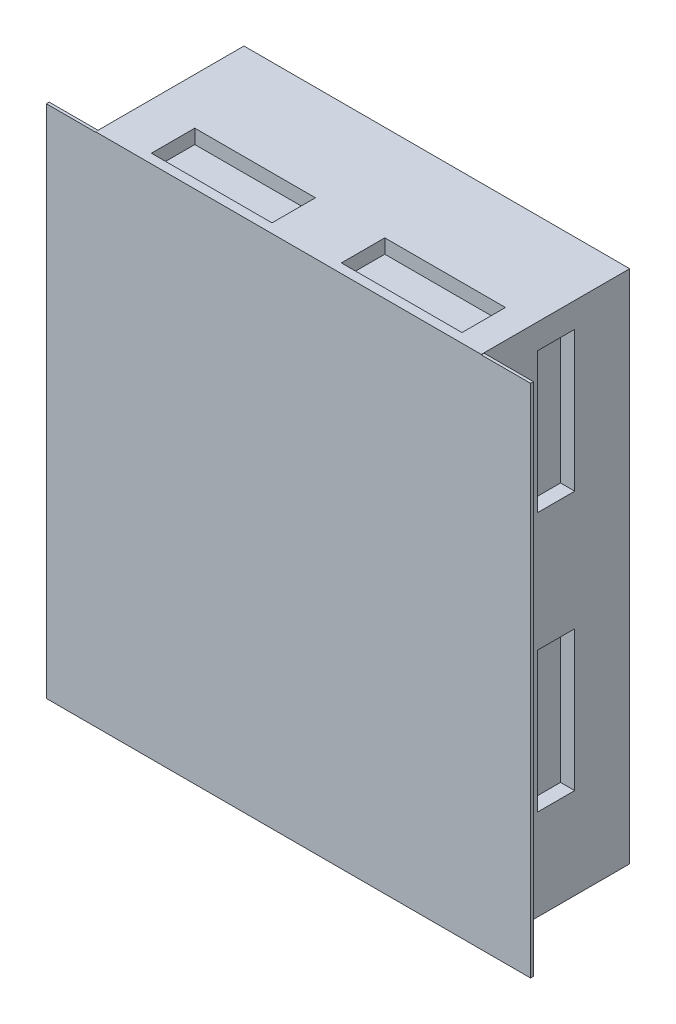
from build123d import *

# Parameters (mm, degrees)
SKETCH1_W           = 135.9
SKETCH1_H           = 52.3
BOSS_EXTRUDE1_DEPTH = 181.6
SKETCH2_W           = 170.6
SKETCH2_H           = 181.46777165
BOSS_EXTRUDE2_DEPTH = 1
BOSS_EXTRUDE3_DEPTH = 6
SKETCH4_W           = 13.2
SKETCH4_H           = 49.4
CUT_EXTRUDE1_DEPTH  = 5
SKETCH5_W           = 42.5
SKETCH5_H           = 15.3
CUT_EXTRUDE2_DEPTH  = 5


with BuildPart() as part:
    # Sketch1 → Boss-Extrude1 (new body)
    with BuildSketch(Plane(origin=(0, 0, 0), x_dir=(1, 0, 0), z_dir=(0, 1, 0))):
        with Locations((0, 1.888738137)):
            Rectangle(SKETCH1_W, SKETCH1_H)
    extrude(amount=BOSS_EXTRUDE1_DEPTH)

    # Sketch2 → Boss-Extrude2 (add)
    with BuildSketch(Plane.XY.offset(24.261261863)):
        with Locations((0, 90.733885825)):
            Rectangle(SKETCH2_W, SKETCH2_H)
    extrude(amount=-BOSS_EXTRUDE2_DEPTH)

    # Sketch3 → Boss-Extrude3 (add)
    # profile 1 of 3: a face of its own
    with BuildSketch(Plane(origin=(0, 0, -28.038738137), x_dir=(-1, 0, 0), z_dir=(0, 0, -1))):
        with BuildLine():
            Line((-12.7, 74.897435897), (-12.7, 77.375360577))
            add(Edge.make_bspline(
                [(-12.7, 77.375360577), (-12.699372317, 77.496660111), (-12.69815571, 77.731768796), (-12.67884905, 78.073624773), (-12.653182672, 78.393931945), (-12.610128703, 78.692124288), (-12.565487417, 78.970142097), (-12.499964695, 79.225162905), (-12.427592462, 79.45932283), (-12.316237959, 79.740500971), (-12.143303013, 80.059536101), (-11.886824054, 80.402439169), (-11.579326494, 80.700511438), (-11.228908769, 80.953961221), (-10.843409562, 81.157360064), (-10.431123013, 81.302648552), (-9.99898535, 81.39598741), (-9.702715027, 81.405466055), (-9.552984776, 81.41025641)],
                knots=[0, 0, 0, 0, 1.00128172, 1.940733171, 2.826250472, 3.653024905, 4.427672124, 5.149348099, 5.824709082, 6.450061444, 7.643590664, 8.808605388, 9.972104426, 11.165284501, 12.367876273, 13.557044126, 14.765369432, 16, 16, 16, 16], degree=3))
            add(Edge.make_bspline(
                [(-9.552984776, 81.41025641), (-9.412737383, 81.406266394), (-9.137138031, 81.398425636), (-8.734737295, 81.324362973), (-8.352077719, 81.20681494), (-7.989486801, 81.044358817), (-7.653714203, 80.835043193), (-7.345800058, 80.584253653), (-7.077381826, 80.282932025), (-6.927377362, 80.057060317), (-6.851181891, 79.942327724)],
                knots=[0, 0, 0, 0, 1.044641374, 2.052818814, 3.038628718, 4.023282556, 5.005660861, 5.98021751, 6.974042014, 8, 8, 8, 8], degree=3))
            add(Edge.make_bspline(
                [(-6.851181891, 79.942327724), (-6.795773816, 80.086587345), (-6.689764444, 80.362591734), (-6.502634166, 80.742633146), (-6.298363579, 81.068868884), (-6.078736215, 81.347671798), (-5.838509805, 81.584860909), (-5.575732619, 81.790280394), (-5.290619783, 81.967869542), (-4.984219176, 82.118996678), (-4.659128296, 82.237708928), (-4.319317807, 82.324960787), (-3.966090372, 82.376572158), (-3.726383162, 82.383612741), (-3.604947917, 82.387179487)],
                knots=[0, 0, 0, 0, 1.272586185, 2.434772614, 3.483318042, 4.437947805, 5.351807173, 6.25737843, 7.180033415, 8.1141739, 9.066731021, 10.025721652, 10.999834114, 12, 12, 12, 12], degree=3))
            add(Edge.make_bspline(
                [(-3.604947917, 82.387179487), (-3.480970476, 82.383635706), (-3.237041389, 82.376663218), (-2.878708535, 82.325199112), (-2.536235817, 82.238121022), (-2.207565879, 82.117970372), (-1.893387826, 81.96223513), (-1.594839821, 81.769971256), (-1.311300739, 81.543877749), (-1.042270168, 81.288355541), (-0.796098738, 81.00359603), (-0.584474326, 80.689772721), (-0.402507492, 80.355482844), (-0.254356585, 79.996452821), (-0.140058258, 79.613599181), (-0.060423762, 79.207134965), (-0.006676125, 78.77772956), (-0.002263135, 78.48305202), (0, 78.33193109)],
                knots=[0, 0, 0, 0, 0.978680899, 1.925582087, 2.851223405, 3.764209995, 4.683484765, 5.614004905, 6.562443559, 7.542772147, 8.539900013, 9.527881485, 10.525548727, 11.540192123, 12.58875426, 13.674701727, 14.807505862, 16, 16, 16, 16], degree=3))
            Line((0, 78.33193109), (0, 74.897435897))
            Line((0, 74.897435897), (-12.7, 74.897435897))
        make_face()
        with BuildLine():
            Line((-11.397435897, 76.037179487), (-7.326923077, 76.037179487))
            Line((-7.326923077, 76.037179487), (-7.326923077, 76.802944712))
            add(Edge.make_bspline(
                [(-7.326923077, 76.802944712), (-7.328374226, 76.914881769), (-7.331178141, 77.131166976), (-7.339210049, 77.444384883), (-7.361700083, 77.735124246), (-7.384183694, 78.002883146), (-7.420739951, 78.247240135), (-7.464254566, 78.46765318), (-7.510274294, 78.667583653), (-7.588545357, 78.898136035), (-7.704184303, 79.159694499), (-7.883820739, 79.438344227), (-8.097610778, 79.685137216), (-8.346602328, 79.891040873), (-8.617797908, 80.061045084), (-8.908816675, 80.18013838), (-9.213802254, 80.259534335), (-9.423579537, 80.266815839), (-9.530088141, 80.270512821)],
                knots=[0, 0, 0, 0, 1.156917035, 2.235399477, 3.236897345, 4.169954739, 5.01148057, 5.788325709, 6.491867502, 7.129259015, 8.302032419, 9.437271567, 10.542795419, 11.662606952, 12.764338259, 13.836858145, 14.901724648, 16, 16, 16, 16], degree=3))
            add(Edge.make_bspline(
                [(-9.530088141, 80.270512821), (-9.600585181, 80.26863572), (-9.738872822, 80.264953584), (-9.941119209, 80.233701339), (-10.131156629, 80.183064407), (-10.310808966, 80.11448835), (-10.475611427, 80.020803281), (-10.633438701, 79.912209977), (-10.774837705, 79.778136125), (-10.906615938, 79.626620769), (-11.024557016, 79.453260178), (-11.12225292, 79.254319294), (-11.210797869, 79.034941042), (-11.276345062, 78.789173572), (-11.333983541, 78.522109268), (-11.370198184, 78.230131982), (-11.393502651, 77.915091911), (-11.396095572, 77.69680871), (-11.397435897, 77.583974359)],
                knots=[0, 0, 0, 0, 0.911708768, 1.788416306, 2.640049961, 3.452993646, 4.268229297, 5.087074648, 5.92553149, 6.781184137, 7.681934069, 8.628939405, 9.643570426, 10.73771997, 11.914765019, 13.176320755, 14.540391495, 16, 16, 16, 16], degree=3))
            Line((-11.397435897, 77.583974359), (-11.397435897, 76.037179487))
        make_face(mode=Mode.SUBTRACT)
        with BuildLine():
            Line((-6.024358974, 76.037179487), (-1.302564103, 76.037179487))
            Line((-1.302564103, 76.037179487), (-1.302564103, 77.660296474))
            add(Edge.make_bspline(
                [(-1.302564103, 77.660296474), (-1.304095014, 77.776467283), (-1.307045645, 78.000371201), (-1.313965487, 78.323904573), (-1.340142198, 78.622987489), (-1.364290096, 78.898563446), (-1.405581964, 79.149901065), (-1.444550751, 79.378933649), (-1.502397133, 79.58190147), (-1.581900179, 79.819420779), (-1.709174685, 80.084912467), (-1.895121537, 80.375047094), (-2.124608659, 80.628039992), (-2.385606798, 80.845210778), (-2.668608428, 81.024429542), (-2.969913842, 81.153035957), (-3.283663222, 81.23295657), (-3.497637425, 81.242599739), (-3.604947917, 81.247435897)],
                knots=[0, 0, 0, 0, 1.160376723, 2.23647316, 3.230273494, 4.158083346, 4.997711197, 5.773399541, 6.476071462, 7.102777513, 8.27340052, 9.405620712, 10.53304798, 11.669441455, 12.787990954, 13.865552736, 14.929550474, 16, 16, 16, 16], degree=3))
            add(Edge.make_bspline(
                [(-3.604947917, 81.247435897), (-3.672053769, 81.246437101), (-3.80518305, 81.24445562), (-4.00079938, 81.214436658), (-4.190382539, 81.171008733), (-4.374722549, 81.113812907), (-4.550719976, 81.033856226), (-4.719049771, 80.935836036), (-4.883102884, 80.823634513), (-5.093187107, 80.650528786), (-5.33223381, 80.395068893), (-5.563384345, 80.032031878), (-5.752809969, 79.621525095), (-5.832891015, 79.323092734), (-5.874258814, 79.168930288)],
                knots=[0, 0, 0, 0, 0.723302347, 1.434937762, 2.129609326, 2.821140842, 3.513216847, 4.209993937, 4.920569932, 5.655069131, 7.14393391, 8.6716197, 10.280644748, 12, 12, 12, 12], degree=3))
            add(Edge.make_bspline(
                [(-5.874258814, 79.168930288), (-5.886795833, 79.107138998), (-5.913978676, 78.973162734), (-5.942672343, 78.754695228), (-5.968235846, 78.505282218), (-5.987144903, 78.224347778), (-6.006690361, 77.911536469), (-6.01429157, 77.566180221), (-6.023360313, 77.189689393), (-6.024017572, 76.928459928), (-6.024358974, 76.792768429)],
                knots=[0, 0, 0, 0, 0.634451884, 1.375622551, 2.216452059, 3.157844607, 4.20941857, 5.370758133, 6.634282058, 8, 8, 8, 8], degree=3))
            Line((-6.024358974, 76.792768429), (-6.024358974, 76.037179487))
        make_face(mode=Mode.SUBTRACT)
    # profile 2 of 3: a face of its own
    with BuildSketch(Plane(origin=(0, 0, -28.038738137), x_dir=(-1, 0, 0), z_dir=(0, 0, -1))):
        Polygon((0, 84.341025641), (-12.7, 86.017568109), (-12.7, 86.180388622), (-2.279487179, 91.423717949), (-12.7, 96.654326923), (-12.7, 96.819691506), (0, 98.506410256), (0, 97.361578526), (-9.138301282, 96.145512821), (0, 91.561097756), (0, 91.304146635), (-9.158653846, 86.701923077), (0, 85.488401442), align=None)
    # profile 3 of 3: a face of its own
    with BuildSketch(Plane(origin=(0, 0, -28.038738137), x_dir=(-1, 0, 0), z_dir=(0, 0, -1))):
        with BuildLine():
            Line((-2.449939904, 99.808974359), (-3.093589744, 100.882572115))
            add(Edge.make_bspline(
                [(-3.093589744, 100.882572115), (-2.926441832, 100.982424005), (-2.606192885, 101.173736372), (-2.173456567, 101.492874161), (-1.805656741, 101.823556438), (-1.504933051, 102.16823202), (-1.268172805, 102.524797032), (-1.100524707, 102.89557917), (-0.995963882, 103.27932894), (-0.983263568, 103.540491092), (-0.976923077, 103.670873397)],
                knots=[0, 0, 0, 0, 1.272034388, 2.437168799, 3.508375237, 4.49857839, 5.41946034, 6.295179144, 7.148887113, 8, 8, 8, 8], degree=3))
            add(Edge.make_bspline(
                [(-0.976923077, 103.670873397), (-0.980098097, 103.78220032), (-0.986392582, 104.002906206), (-1.044430861, 104.32845764), (-1.139381365, 104.643051192), (-1.268097053, 104.943559604), (-1.426316618, 105.222021371), (-1.612887178, 105.470120965), (-1.828462782, 105.679614769), (-2.065057372, 105.853287666), (-2.318766121, 105.987674491), (-2.580176948, 106.08924536), (-2.852876607, 106.146130517), (-3.036527641, 106.154666629), (-3.129206731, 106.158974359)],
                knots=[0, 0, 0, 0, 1.09553864, 2.171907928, 3.244545276, 4.325730702, 5.384330216, 6.391480148, 7.371786628, 8.333890167, 9.27165687, 10.191402356, 11.087295184, 12, 12, 12, 12], degree=3))
            add(Edge.make_bspline(
                [(-3.129206731, 106.158974359), (-3.234981678, 106.153739616), (-3.449187481, 106.143138691), (-3.765763708, 106.049712033), (-4.080405344, 105.907053436), (-4.275068124, 105.772970388), (-4.375801282, 105.703585737)],
                knots=[0, 0, 0, 0, 0.938992559, 1.901562324, 2.914110574, 4, 4, 4, 4], degree=3))
            add(Edge.make_bspline(
                [(-4.375801282, 105.703585737), (-4.44855181, 105.64673213), (-4.601282444, 105.527375094), (-4.828433672, 105.322005753), (-5.063214745, 105.082245695), (-5.31077993, 104.811376418), (-5.569072987, 104.508943559), (-5.8401095, 104.174830107), (-6.118350813, 103.806184594), (-6.304718666, 103.547433553), (-6.40088141, 103.413922276)],
                knots=[0, 0, 0, 0, 0.72225051, 1.516274602, 2.393638633, 3.3469932, 4.386926276, 5.505032946, 6.712638081, 8, 8, 8, 8], degree=3))
            add(Edge.make_bspline(
                [(-6.40088141, 103.413922276), (-6.496053714, 103.280303775), (-6.678015911, 103.024835377), (-6.948069742, 102.667571379), (-7.194971783, 102.348095756), (-7.421046341, 102.067828467), (-7.626324078, 101.826892787), (-7.808833743, 101.623390124), (-7.973511235, 101.462504503), (-8.080341247, 101.373039967), (-8.128305288, 101.332872596)],
                knots=[0, 0, 0, 0, 1.452282411, 2.77665338, 3.964542531, 5.026858415, 5.96415736, 6.766646006, 7.446254459, 8, 8, 8, 8], degree=3))
            add(Edge.make_bspline(
                [(-8.128305288, 101.332872596), (-8.203061333, 101.276738771), (-8.350079127, 101.16634407), (-8.579805018, 101.020464755), (-8.814519473, 100.897444333), (-9.055073148, 100.798435892), (-9.299658139, 100.718371518), (-9.550110695, 100.662706238), (-9.804730594, 100.628395336), (-9.976042223, 100.624851118), (-10.061798878, 100.623076923)],
                knots=[0, 0, 0, 0, 1.068019517, 2.100403715, 3.106014851, 4.09224787, 5.069873182, 6.043214339, 7.020455327, 8, 8, 8, 8], degree=3))
            add(Edge.make_bspline(
                [(-10.061798878, 100.623076923), (-10.196164323, 100.627812756), (-10.462023245, 100.637183198), (-10.850388447, 100.716436134), (-11.221193366, 100.841512091), (-11.570681509, 101.01679636), (-11.890071901, 101.242541465), (-12.182239357, 101.504920656), (-12.431208535, 101.814535247), (-12.645348186, 102.157301617), (-12.814690808, 102.530515062), (-12.937413997, 102.923427663), (-13.010310029, 103.333215039), (-13.020480481, 103.611221575), (-13.025641026, 103.752283654)],
                knots=[0, 0, 0, 0, 1.005248779, 1.989011071, 2.95484373, 3.928844559, 4.904706341, 5.875556129, 6.859318422, 7.868909462, 8.894684146, 9.918924798, 10.944050749, 12, 12, 12, 12], degree=3))
            add(Edge.make_bspline(
                [(-13.025641026, 103.752283654), (-13.020549285, 103.90196505), (-13.010423439, 104.199633574), (-12.920190732, 104.636788328), (-12.776581296, 105.05939938), (-12.608089803, 105.397855253), (-12.440878214, 105.663308477), (-12.288243775, 105.865547256), (-12.112888377, 106.071599983), (-11.911115259, 106.279252208), (-11.686960086, 106.490553889), (-11.438525366, 106.704531722), (-11.168049902, 106.923188172), (-10.974912741, 107.063808675), (-10.875901442, 107.135897436)],
                knots=[0, 0, 0, 0, 1.286507425, 2.558452658, 3.822738219, 5.118007103, 5.800084425, 6.519418873, 7.295692132, 8.12638276, 9.008892966, 9.945018126, 10.946518512, 12, 12, 12, 12], degree=3))
            Line((-10.875901442, 107.135897436), (-10.094871795, 106.105548878))
            add(Edge.make_bspline(
                [(-10.094871795, 106.105548878), (-10.175026824, 106.043338173), (-10.32938667, 105.923534901), (-10.545483741, 105.741576141), (-10.743146913, 105.570335507), (-10.914381231, 105.400331009), (-11.072009393, 105.244666548), (-11.204569572, 105.090901567), (-11.316250039, 104.944969876), (-11.435651319, 104.761464808), (-11.550429634, 104.529005922), (-11.651248892, 104.239632019), (-11.711060256, 103.936202431), (-11.719038173, 103.729647009), (-11.723076923, 103.625080128)],
                knots=[0, 0, 0, 0, 1.181392137, 2.275085037, 3.289537922, 4.225335853, 5.084247276, 5.86831218, 6.587234301, 7.222706459, 8.415108401, 9.595592188, 10.782789524, 12, 12, 12, 12], degree=3))
            add(Edge.make_bspline(
                [(-11.723076923, 103.625080128), (-11.718752177, 103.493852643), (-11.710412313, 103.240792801), (-11.6169317, 102.882358919), (-11.474800726, 102.55788681), (-11.269849343, 102.279763141), (-11.025507819, 102.050120741), (-10.746853518, 101.881944814), (-10.439090687, 101.781395384), (-10.224507915, 101.769088308), (-10.115224359, 101.762820513)],
                knots=[0, 0, 0, 0, 1.144248881, 2.206576175, 3.214949548, 4.222996039, 5.203671638, 6.127710127, 7.046472867, 8, 8, 8, 8], degree=3))
            add(Edge.make_bspline(
                [(-10.115224359, 101.762820513), (-10.047198882, 101.764328492), (-9.910200307, 101.767365458), (-9.708759769, 101.806172964), (-9.508381362, 101.858643902), (-9.309770314, 101.939084365), (-9.10842921, 102.051104372), (-8.901514272, 102.198050628), (-8.687243251, 102.383165272), (-8.547879003, 102.524957622), (-8.474298878, 102.599819712)],
                knots=[0, 0, 0, 0, 0.858259122, 1.72847414, 2.583651051, 3.473048463, 4.427392529, 5.488649985, 6.674082839, 8, 8, 8, 8], degree=3))
            add(Edge.make_bspline(
                [(-8.474298878, 102.599819712), (-8.449490242, 102.627619549), (-8.3905506, 102.693665598), (-8.29405861, 102.814409671), (-8.175031408, 102.973859253), (-8.027757431, 103.167850669), (-7.856918983, 103.39996081), (-7.664700447, 103.6702152), (-7.444861782, 103.975601333), (-7.29116442, 104.192306571), (-7.209895833, 104.306891026)],
                knots=[0, 0, 0, 0, 0.420754252, 0.999615792, 1.744751191, 2.668019286, 3.750313428, 4.999500688, 6.413464383, 8, 8, 8, 8], degree=3))
            add(Edge.make_bspline(
                [(-7.209895833, 104.306891026), (-7.109597115, 104.444725528), (-6.915382548, 104.711622938), (-6.623589467, 105.091381758), (-6.338207139, 105.435706214), (-6.06107656, 105.745830683), (-5.794237908, 106.024733648), (-5.53468775, 106.269603606), (-5.28412818, 106.48155159), (-4.965079672, 106.712844905), (-4.569607367, 106.946382589), (-4.084860795, 107.146621958), (-3.598723152, 107.274010817), (-3.272402448, 107.290555115), (-3.111398237, 107.298717949)],
                knots=[0, 0, 0, 0, 1.163604038, 2.253157948, 3.268574773, 4.215621239, 5.091738613, 5.902582348, 6.650434646, 7.330118262, 8.591011492, 9.77460283, 10.902005569, 12, 12, 12, 12], degree=3))
            add(Edge.make_bspline(
                [(-3.111398237, 107.298717949), (-2.997540804, 107.296331046), (-2.772036973, 107.291603592), (-2.440893869, 107.237352188), (-2.119355657, 107.157683682), (-1.811714808, 107.038572643), (-1.513035142, 106.89082255), (-1.228943203, 106.706029727), (-0.953919697, 106.49071111), (-0.695674961, 106.243841715), (-0.458314775, 105.973848166), (-0.24804448, 105.687456451), (-0.068682233, 105.38765624), (0.074162208, 105.0712009), (0.186635166, 104.741489999), (0.267899266, 104.397436274), (0.317829828, 104.038691204), (0.323008226, 103.794848079), (0.325641026, 103.670873397)],
                knots=[0, 0, 0, 0, 0.983922938, 1.948738757, 2.895227473, 3.844781104, 4.796118043, 5.772795661, 6.770647148, 7.813532943, 8.8582745, 9.876489951, 10.882905461, 11.874265028, 12.874055871, 13.891769171, 14.928133632, 16, 16, 16, 16], degree=3))
            add(Edge.make_bspline(
                [(0.325641026, 103.670873397), (0.323786166, 103.574950867), (0.320099808, 103.384313853), (0.287510594, 103.102339443), (0.241401949, 102.82606152), (0.168198939, 102.558946787), (0.079382315, 102.297554086), (-0.029976158, 102.043019109), (-0.161032351, 101.795222894), (-0.310865281, 101.552759953), (-0.485281322, 101.31631193), (-0.688245291, 101.087840197), (-0.914581665, 100.8613343), (-1.167786954, 100.638400996), (-1.450645541, 100.423903986), (-1.758944131, 100.212693885), (-2.093599536, 100.005800015), (-2.328941218, 99.875808341), (-2.449939904, 99.808974359)],
                knots=[0, 0, 0, 0, 0.915313873, 1.819100311, 2.706792138, 3.586475221, 4.459428225, 5.3405999, 6.2277379, 7.133009489, 8.059106158, 9.028520402, 10.047404263, 11.114294124, 12.246039232, 13.433834781, 14.680630578, 16, 16, 16, 16], degree=3))
        make_face()
    extrude(amount=BOSS_EXTRUDE3_DEPTH)

    # Sketch4 → Cut-Extrude1 (cut)
    with BuildSketch(Plane(origin=(67.95, 0, 0), x_dir=(0, 0, -1), z_dir=(1, 0, 0))):
        with Locations((2.066635523, 56.7445243)):
            Rectangle(SKETCH4_W, SKETCH4_H)
        with Locations((2.066635523, 148.09795399)):
            Rectangle(SKETCH4_W, SKETCH4_H)
    extrude(amount=-CUT_EXTRUDE1_DEPTH, mode=Mode.SUBTRACT)

    # Sketch5 → Cut-Extrude2 (cut)
    with BuildSketch(Plane(origin=(0, 181.6, 0), x_dir=(1, 0, 0), z_dir=(0, 1, 0))):
        with Locations((-30.301737417, -13.340909468)):
            Rectangle(SKETCH5_W, SKETCH5_H)
        with Locations((36.638578334, -13.340909468)):
            Rectangle(SKETCH5_W, SKETCH5_H)
    extrude(amount=-CUT_EXTRUDE2_DEPTH, mode=Mode.SUBTRACT)


solid = part.part
